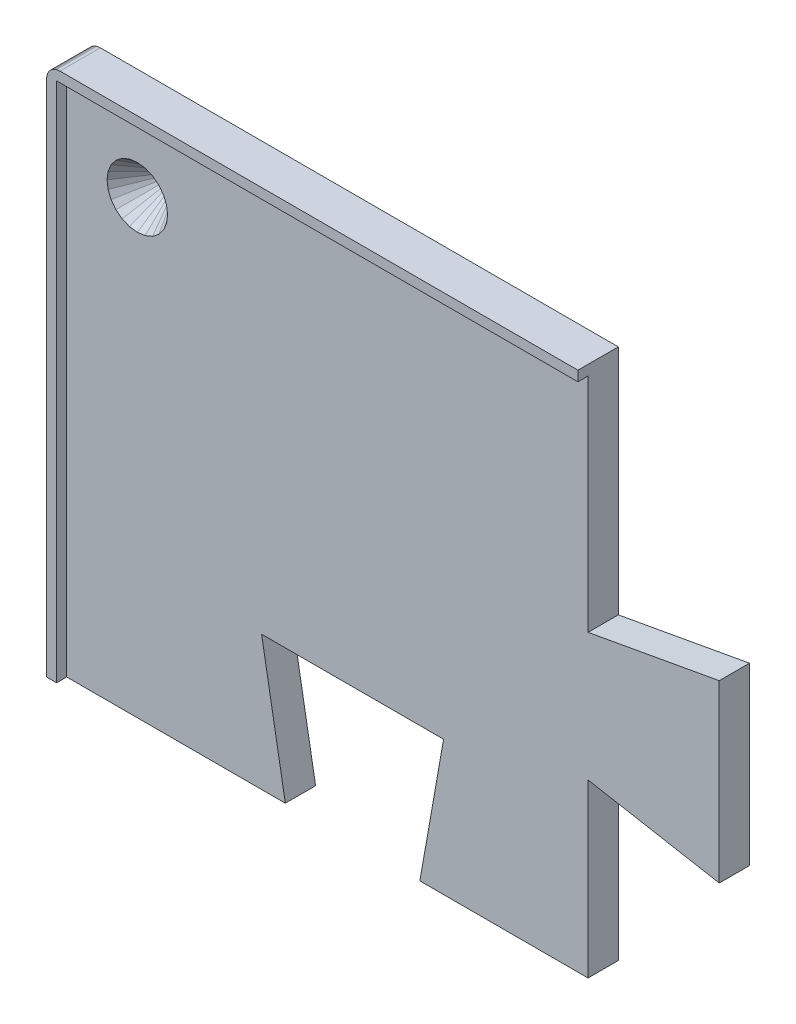
from build123d import *

# Parameters (mm, degrees)
BOSS_EXTRUDE1_DEPTH = 6
SKETCH2_W           = 4.5
SKETCH2_H           = 48.026539614
BOSS_EXTRUDE2_DEPTH = 19.5
SKETCH3_W           = 1.5
SKETCH3_H           = 77.5
CUT_EXTRUDE1_DEPTH  = 77.5
SKETCH4_W           = 27.053079228
SKETCH4_H           = 20
CUT_EXTRUDE2_DEPTH  = 184.532694635
SKETCH5_W           = 19.5
SKETCH5_H           = 21.973460386
CUT_EXTRUDE3_DEPTH  = 184.532694635
CUT_EXTRUDE4_DEPTH  = 4.5
CUT_EXTRUDE4_TAPER  = -33.463237765
DRAFT1_ANGLE        = -10
DRAFT2_ANGLE        = -10.251039049


with BuildPart() as part:
    # Sketch1 → Boss-Extrude1 (new body)
    with BuildSketch(Plane.XY.offset(9.15)):
        Polygon((-2, 77), (77, 77), (77, 156), (0, 156), (-0.51763809, 155.931851653), (-0.765366865, 155.847759065), (-1, 155.732050808), (-1.217522858, 155.586706681), (-1.414213562, 155.414213562), (-1.586706681, 155.217522858), (-1.732050808, 155), (-1.847759065, 154.765366865), (-1.931851653, 154.51763809), (-2, 154), align=None)
    extrude(amount=-BOSS_EXTRUDE1_DEPTH)

    # Sketch2 → Boss-Extrude2 (add)
    with BuildSketch(Plane(origin=(77, 0, 0), x_dir=(0, 0, -1), z_dir=(1, 0, 0))):
        with Locations((-5.4, 101.013269807)):
            Rectangle(SKETCH2_W, SKETCH2_H)
    extrude(amount=BOSS_EXTRUDE2_DEPTH)

    # Sketch3 → Cut-Extrude1 (cut)
    with BuildSketch(Plane(origin=(77, 0, 0), x_dir=(0, 0, -1), z_dir=(1, 0, 0))):
        with Locations((-8.4, 115.75)):
            Rectangle(SKETCH3_W, SKETCH3_H)
    extrude(amount=-CUT_EXTRUDE1_DEPTH, mode=Mode.SUBTRACT)

    # Sketch4 → Cut-Extrude2 (cut, through all)
    with BuildSketch(Plane(origin=(0, 0, 3.15), x_dir=(-1, 0, 0), z_dir=(0, 0, -1))):
        with Locations((-42, 87)):
            Rectangle(SKETCH4_W, SKETCH4_H)
    extrude(amount=-CUT_EXTRUDE2_DEPTH, mode=Mode.SUBTRACT)

    # Sketch5 → Cut-Extrude3 (cut, through all)
    with BuildSketch(Plane(origin=(0, 0, 3.15), x_dir=(-1, 0, 0), z_dir=(0, 0, -1))):
        with Locations((-86.75, 87.986730193)):
            Rectangle(SKETCH5_W, SKETCH5_H)
    extrude(amount=-CUT_EXTRUDE3_DEPTH, mode=Mode.SUBTRACT)

    # Sketch6 → Cut-Extrude4 (cut)
    with BuildSketch(Plane(origin=(0, 0, 3.15), x_dir=(-1, 0, 0), z_dir=(0, 0, -1))):
        Polygon((-11.060660172, 142.939339828), (-10.75, 142.700961894), (-10.388228568, 142.551111261), (-10, 142.5), (-9.611771432, 142.551111261), (-9.25, 142.700961894), (-8.939339828, 142.939339828), (-8.700961894, 143.25), (-8.551111261, 143.611771432), (-8.5, 144), (-8.551111261, 144.388228568), (-8.700961894, 144.75), (-8.939339828, 145.060660172), (-9.25, 145.299038106), (-9.611771432, 145.448888739), (-10, 145.5), (-10.388228568, 145.448888739), (-10.75, 145.299038106), (-11.060660172, 145.060660172), (-11.299038106, 144.75), (-11.448888739, 144.388228568), (-11.5, 144), (-11.448888739, 143.611771432), (-11.299038106, 143.25), align=None)
    extrude(amount=-CUT_EXTRUDE4_DEPTH, taper=CUT_EXTRUDE4_TAPER, mode=Mode.SUBTRACT)

    # Draft1
    draft1_faces = [part.faces().sort_by_distance(p)[0] for p in [
        (55.526539614, 87, 5.4),
        (28.473460386, 87, 5.4),
    ]]
    draft(draft1_faces, Plane(origin=(28.473460386, 97, 9.15), x_dir=(-1, 0, 0), z_dir=(0, -1, 0)), DRAFT1_ANGLE)

    # Draft2
    draft2_faces = [part.faces().sort_by_distance(p)[0] for p in [
        (86.75, 98.973460386, 5.4),
        (86.75, 125.026539614, 5.4),
    ]]
    draft(draft2_faces, Plane.YZ.offset(96.5), DRAFT2_ANGLE)


solid = part.part
